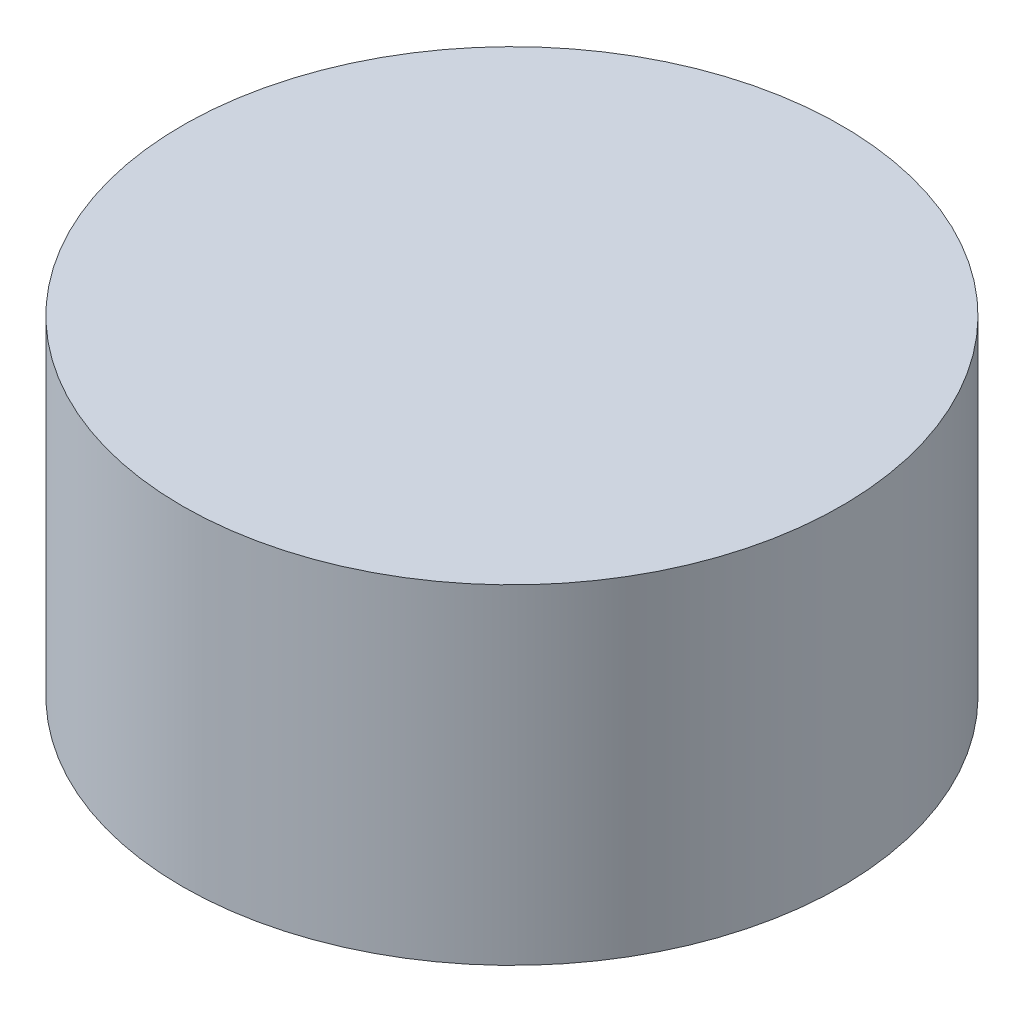
from build123d import *

# Parameters (mm, degrees)
SKETCH1_R           = 0.396875
BOSS_EXTRUDE1_DEPTH = 0.396875


with BuildPart() as part:
    # Sketch1 → Boss-Extrude1 (new body)
    with BuildSketch(Plane(origin=(0, 0, 0), x_dir=(1, 0, 0), z_dir=(0, 1, 0))):
        with Locations(Location((0, 0, 0), (0, 0, 270))):
            Circle(SKETCH1_R)
    extrude(amount=BOSS_EXTRUDE1_DEPTH)


solid = part.part
